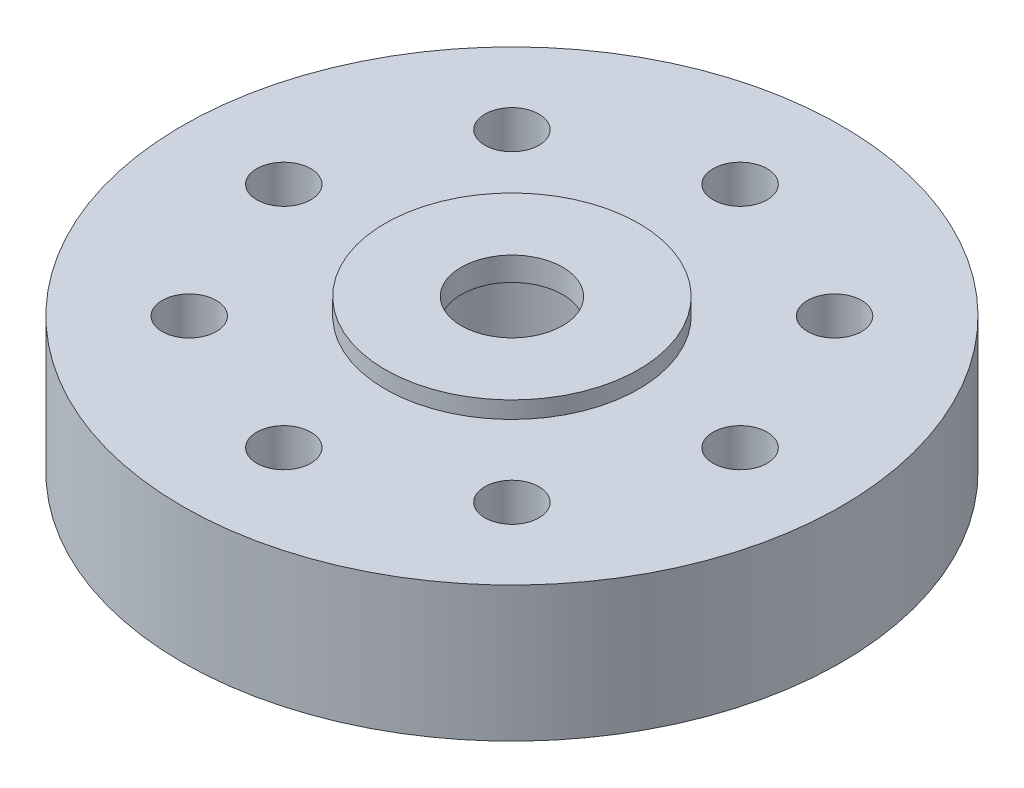
from build123d import *

# Parameters (mm, degrees)
CROQUIS1_R              = 9.75
CROQUIS1_R_2            = 0.8
CROQUIS1_R_3            = 1.5
SALIENTE_EXTRUIR1_DEPTH = 2
CROQUIS1_3_R            = 3.75
CROQUIS1_3_R_2          = 1.5
SALIENTE_EXTRUIR2_DEPTH = 2.5
CROQUIS2_R              = 4.4
CORTAR_EXTRUIR3_DEPTH   = 3.8
CROQUIS2_6_R            = 4.4
CROQUIS2_6_R_2          = 3.75
SALIENTE_EXTRUIR3_DEPTH = 0.5
CROQUIS2_9_R            = 2.5
CORTAR_EXTRUIR4_DEPTH   = 3.8


with BuildPart() as part:
    # Croquis1 → Saliente-Extruir1 (new, symmetric)
    with BuildSketch(Plane(origin=(0, 0, 0), x_dir=(1, 0, 0), z_dir=(0, 1, 0))):
        Circle(CROQUIS1_R)
        with Locations((-4.772970773, -4.772970773)):
            Circle(CROQUIS1_R_2, mode=Mode.SUBTRACT)
        with Locations((0, -6.75)):
            Circle(CROQUIS1_R_2, mode=Mode.SUBTRACT)
        with Locations((4.772970773, -4.772970773)):
            Circle(CROQUIS1_R_2, mode=Mode.SUBTRACT)
        with Locations((-6.75, 0)):
            Circle(CROQUIS1_R_2, mode=Mode.SUBTRACT)
        with Locations((-4.772970773, 4.772970773)):
            Circle(CROQUIS1_R_2, mode=Mode.SUBTRACT)
        with Locations((4.772970773, 4.772970773)):
            Circle(CROQUIS1_R_2, mode=Mode.SUBTRACT)
        with Locations((6.75, 0)):
            Circle(CROQUIS1_R_2, mode=Mode.SUBTRACT)
        with Locations((0, 6.75)):
            Circle(CROQUIS1_R_2, mode=Mode.SUBTRACT)
        Circle(CROQUIS1_R_3, mode=Mode.SUBTRACT)
    extrude(amount=SALIENTE_EXTRUIR1_DEPTH, both=True)

    # Croquis1<3> → Saliente-Extruir2 (add, symmetric)
    with BuildSketch(Plane(origin=(0, 0, 0), x_dir=(1, 0, 0), z_dir=(0, 1, 0))):
        Circle(CROQUIS1_3_R)
        Circle(CROQUIS1_3_R_2, mode=Mode.SUBTRACT)
    extrude(amount=SALIENTE_EXTRUIR2_DEPTH, both=True)

    # Croquis2 → Cortar-Extruir3 (cut)
    with BuildSketch(Plane.XZ.offset(2)):
        with BuildLine():
            ThreePointArc((8.493703704, -0.979539378), (4.75, 0), (8.493703704, 0.979539378))
            ThreePointArc((8.493703704, 0.979539378), (7.899170003, 3.271943347), (6.698594423, 5.313316549))
            ThreePointArc((6.698594423, 5.313316549), (6.754289437, 5.045691051), (6.772970773, 4.772970773))
            ThreePointArc((6.772970773, 4.772970773), (3.179124552, 3.564809267), (5.313316549, 6.698594423))
            ThreePointArc((5.313316549, 6.698594423), (3.271943347, 7.899170003), (0.979539378, 8.493703704))
            ThreePointArc((0.979539378, 8.493703704), (1.72613423, 7.76017851), (2, 6.75))
            ThreePointArc((2, 6.75), (-1.01017851, 5.02386577), (-0.979539378, 8.493703704))
            ThreePointArc((-0.979539378, 8.493703704), (-3.271943347, 7.899170003), (-5.313316549, 6.698594423))
            ThreePointArc((-5.313316549, 6.698594423), (-3.564809267, 6.366816994), (-2.772970773, 4.772970773))
            ThreePointArc((-2.772970773, 4.772970773), (-5.045691051, 2.791652109), (-6.698594423, 5.313316549))
            ThreePointArc((-6.698594423, 5.313316549), (-7.899170003, 3.271943347), (-8.493703704, 0.979539378))
            ThreePointArc((-8.493703704, 0.979539378), (-6.243742856, 1.934865293), (-4.75, 0))
            ThreePointArc((-4.75, 0), (-6.243742856, -1.934865293), (-8.493703704, -0.979539378))
            ThreePointArc((-8.493703704, -0.979539378), (-7.899170003, -3.271943347), (-6.698594423, -5.313316549))
            ThreePointArc((-6.698594423, -5.313316549), (-5.045691051, -2.791652109), (-2.772970773, -4.772970773))
            ThreePointArc((-2.772970773, -4.772970773), (-3.564809267, -6.366816994), (-5.313316549, -6.698594423))
            ThreePointArc((-5.313316549, -6.698594423), (-3.271943347, -7.899170003), (-0.979539378, -8.493703704))
            ThreePointArc((-0.979539378, -8.493703704), (-1.01017851, -5.02386577), (2, -6.75))
            ThreePointArc((2, -6.75), (1.72613423, -7.76017851), (0.979539378, -8.493703704))
            ThreePointArc((0.979539378, -8.493703704), (3.271943347, -7.899170003), (5.313316549, -6.698594423))
            ThreePointArc((5.313316549, -6.698594423), (3.179124552, -3.564809267), (6.772970773, -4.772970773))
            ThreePointArc((6.772970773, -4.772970773), (6.754289437, -5.045691051), (6.698594423, -5.313316549))
            ThreePointArc((6.698594423, -5.313316549), (7.899170003, -3.271943347), (8.493703704, -0.979539378))
        make_face()
        Circle(CROQUIS2_R, mode=Mode.SUBTRACT)
    extrude(amount=-CORTAR_EXTRUIR3_DEPTH, mode=Mode.SUBTRACT)

    # Croquis2<6> → Saliente-Extruir3 (add)
    with BuildSketch(Plane.XZ.offset(2)):
        Circle(CROQUIS2_6_R)
        Circle(CROQUIS2_6_R_2, mode=Mode.SUBTRACT)
    extrude(amount=SALIENTE_EXTRUIR3_DEPTH)

    # Croquis2<9> → Cortar-Extruir4 (cut, symmetric)
    with BuildSketch(Plane.XZ.offset(2)):
        Circle(CROQUIS2_9_R)
    extrude(amount=CORTAR_EXTRUIR4_DEPTH, both=True, mode=Mode.SUBTRACT)


solid = part.part
